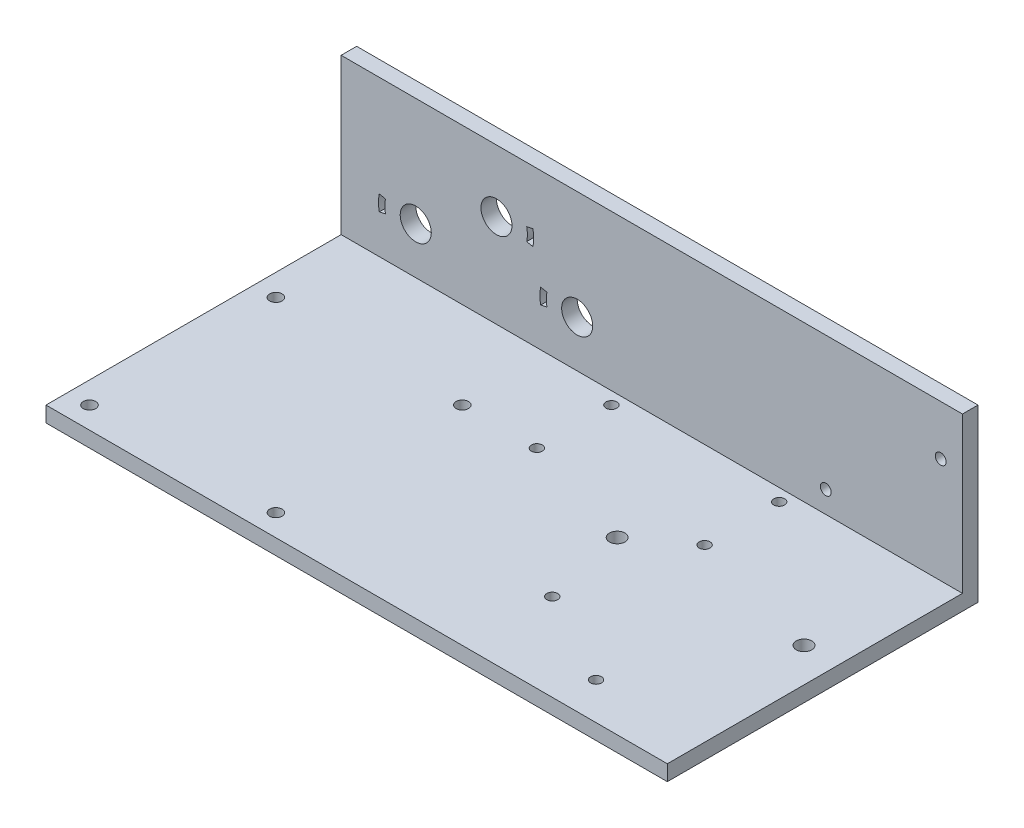
from build123d import *

# Parameters (mm, degrees)
SKETCH1_W           = 200
SKETCH1_H           = 100
BOSS_EXTRUDE1_DEPTH = 5
SKETCH2_W           = 200
SKETCH2_H           = 5
BOSS_EXTRUDE2_DEPTH = 50
SKETCH3_R           = 1.75
CUT_EXTRUDE1_DEPTH  = 50
SKETCH4_R           = 2.5
CUT_EXTRUDE2_DEPTH  = 123.474487139
SKETCH7_R           = 2
CUT_EXTRUDE3_DEPTH  = 123.474487139
SKETCH8_R           = 1.75
CUT_EXTRUDE4_DEPTH  = 123.474487139
SKETCH11_R          = 5
CUT_EXTRUDE6_DEPTH  = 149.492424049
SKETCH12_R          = 1.75
CUT_EXTRUDE7_DEPTH  = 123.474487139


with BuildPart() as part:
    # Sketch1 → Boss-Extrude1 (new body)
    with BuildSketch(Plane(origin=(0, 0, 0), x_dir=(1, 0, 0), z_dir=(0, 1, 0))):
        Rectangle(SKETCH1_W, SKETCH1_H)
    extrude(amount=BOSS_EXTRUDE1_DEPTH)

    # Sketch2 → Boss-Extrude2 (add)
    with BuildSketch(Plane(origin=(0, 5, 0), x_dir=(1, 0, 0), z_dir=(0, 1, 0))):
        with Locations((0, 47.5)):
            Rectangle(SKETCH2_W, SKETCH2_H)
    extrude(amount=BOSS_EXTRUDE2_DEPTH)

    # Sketch3 → Cut-Extrude1 (cut)
    with BuildSketch(Plane(origin=(0, 0, -50), x_dir=(-1, 0, 0), z_dir=(0, 0, -1))):
        with Locations((-93, 39)):
            Circle(SKETCH3_R)
        with Locations((-56, 12)):
            Circle(SKETCH3_R)
    extrude(amount=-CUT_EXTRUDE1_DEPTH, mode=Mode.SUBTRACT)

    # Sketch4 → Cut-Extrude2 (cut, through all)
    with BuildSketch(Plane(origin=(0, 5, 0), x_dir=(1, 0, 0), z_dir=(0, 1, 0))):
        with Locations(Location((28.85, 5, 0), (0, 0, 270))):
            Circle(SKETCH4_R)
        with Locations(Location((89, 5, 0), (0, 0, 270))):
            Circle(SKETCH4_R)
    extrude(amount=-CUT_EXTRUDE2_DEPTH, mode=Mode.SUBTRACT)

    # Sketch7 → Cut-Extrude3 (cut, through all)
    with BuildSketch(Plane(origin=(0, 5, 0), x_dir=(1, 0, 0), z_dir=(0, 1, 0))):
        with Locations(Location((-93, 17, 0), (0, 0, 270))):
            Circle(SKETCH7_R)
        with Locations(Location((-33, 17, 0), (0, 0, 270))):
            Circle(SKETCH7_R)
        with Locations(Location((-33, -43, 0), (0, 0, 270))):
            Circle(SKETCH7_R)
        with Locations(Location((-93, -43, 0), (0, 0, 270))):
            Circle(SKETCH7_R)
    extrude(amount=-CUT_EXTRUDE3_DEPTH, mode=Mode.SUBTRACT)

    # Sketch8 → Cut-Extrude4 (cut, through all)
    with BuildSketch(Plane(origin=(0, 5, 0), x_dir=(1, 0, 0), z_dir=(0, 1, 0))):
        with Locations(Location((65.125, -38.08, 0), (0, 0, 270))):
            Circle(SKETCH8_R)
        with Locations(Location((34.875, -21.92, 0), (0, 0, 270))):
            Circle(SKETCH8_R)
    extrude(amount=-CUT_EXTRUDE4_DEPTH, mode=Mode.SUBTRACT)

    # Sketch11 → Cut-Extrude6 (cut, through all)
    with BuildSketch(Plane.XY.offset(-45)):
        with Locations((-75.980762114, 20)):
            Circle(SKETCH11_R)
        with Locations((-50, 35)):
            Circle(SKETCH11_R)
        with Locations((-24.019237886, 20)):
            Circle(SKETCH11_R)
        with BuildLine():
            Line((-87.717456708, 22.5), (-85.717456708, 22.073985677))
            ThreePointArc((-85.717456708, 22.073985677), (-85.935893364, 20), (-85.717456708, 17.926014323))
            Line((-85.717456708, 17.926014323), (-87.717456708, 17.5))
            ThreePointArc((-87.717456708, 17.5), (-87.980762114, 20), (-87.717456708, 22.5))
        make_face()
        with BuildLine():
            Line((-40.263305406, 37.073985677), (-38.263305406, 37.5))
            ThreePointArc((-38.263305406, 37.5), (-38, 35), (-38.263305406, 32.5))
            Line((-38.263305406, 32.5), (-40.263305406, 32.926014323))
            ThreePointArc((-40.263305406, 32.926014323), (-40.04486875, 35), (-40.263305406, 37.073985677))
        make_face()
        with BuildLine():
            Line((-35.755932481, 22.5), (-33.755932481, 22.073985677))
            ThreePointArc((-33.755932481, 22.073985677), (-33.974369137, 20), (-33.755932481, 17.926014323))
            Line((-33.755932481, 17.926014323), (-35.755932481, 17.5))
            ThreePointArc((-35.755932481, 17.5), (-36.019237886, 20), (-35.755932481, 22.5))
        make_face()
    extrude(amount=-CUT_EXTRUDE6_DEPTH, mode=Mode.SUBTRACT)

    # Sketch12 → Cut-Extrude7 (cut, through all)
    with BuildSketch(Plane(origin=(0, 5, 0), x_dir=(1, 0, 0), z_dir=(0, 1, 0))):
        with Locations(Location((-9, 41, 0), (0, 0, 270))):
            Circle(SKETCH12_R)
        with Locations(Location((45, 41, 0), (0, 0, 270))):
            Circle(SKETCH12_R)
        with Locations(Location((-9, 17, 0), (0, 0, 270))):
            Circle(SKETCH12_R)
        with Locations(Location((45, 17, 0), (0, 0, 270))):
            Circle(SKETCH12_R)
    extrude(amount=-CUT_EXTRUDE7_DEPTH, mode=Mode.SUBTRACT)


solid = part.part
